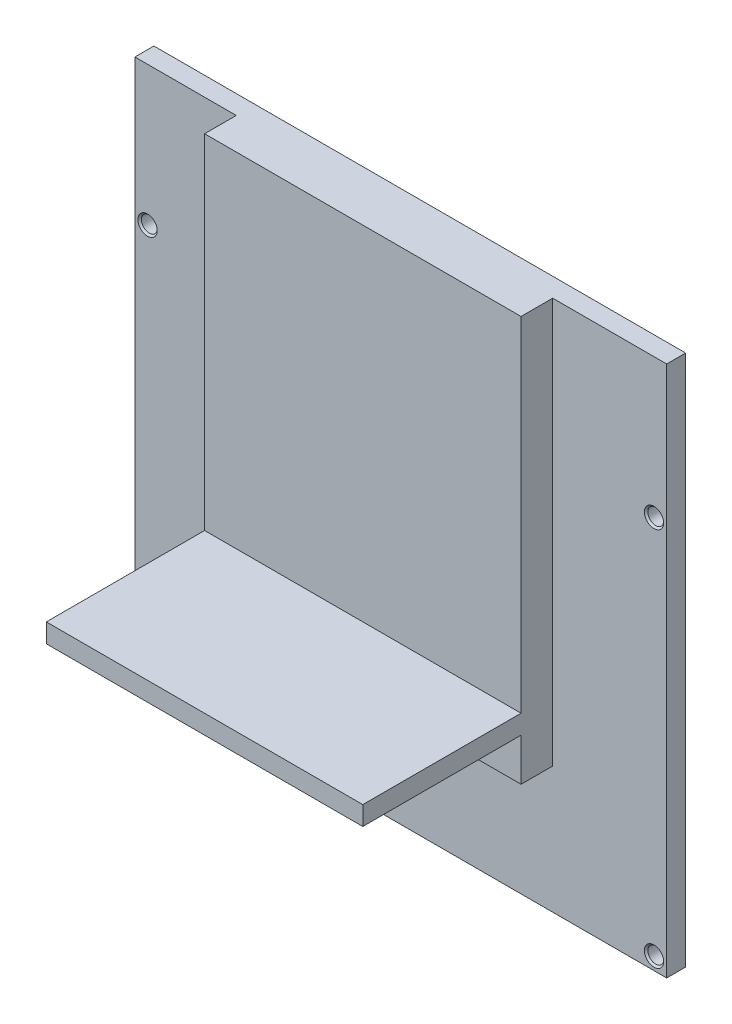
from build123d import *

# Parameters (mm, degrees)
SKETCH_2_W                   = 62
SKETCH_2_H                   = 45
EXTRUDE_3_DEPTH              = 8
SKETCH_3_W                   = 3.004963504
SKETCH_3_H                   = 5
CUT_EXTRUDE_1_DEPTH          = 58.648048048
EXTRUDE_4_DEPTH              = 3
SKETCH_6_W                   = 3
SKETCH_6_H                   = 5
EXTRUDE_5_DEPTH              = 2
SKETCH_7_W                   = 3
SKETCH_7_H                   = 5
EXTRUDE_6_DEPTH              = 2
SKETCH_8_W                   = 49.990072992
SKETCH_8_H                   = 5
EXTRUDE_7_DEPTH              = 2
SKETCH_9_W                   = 3
SKETCH_9_H                   = 5
CUT_EXTRUDE_2_DEPTH          = 66.65020057
SKETCH_10_W                  = 3
SKETCH_10_H                  = 5
CUT_EXTRUDE_4_DEPTH          = 66.65020057
SKETCH_11_W                  = 49.990072992
SKETCH_11_H                  = 5
EXTRUDE_8_DEPTH              = 17
SKETCH_12_W                  = 49.990072992
SKETCH_12_H                  = 3
EXTRUDE_9_DEPTH              = 25
EXTRUDE_START                = 3.72
SKETCH_16_W                  = 49.990072992
SKETCH_16_H                  = 25
EXTRUDE_10_DEPTH             = 3
SKETCH_17_W                  = 49.990072992
SKETCH_17_H                  = 25
CUT_EXTRUDE_5_DEPTH          = 81.043408441
SKETCH_18_W                  = 84
SKETCH_18_H                  = 3
EXTRUDE_11_DEPTH             = 20
HOLE_WIZARD_M3_2_D           = 2.5
HOLE_WIZARD_M3_2_CSINK_D     = 3.05
HOLE_WIZARD_M3_2_CSINK_ANGLE = 90


with BuildPart() as part:
    # 草图2 → 凸台-拉伸3 (new body)
    with BuildSketch(Plane.XY):
        with Locations((-4.132569558, -3.93531014)):
            Rectangle(SKETCH_2_W, SKETCH_2_H)
    extrude(amount=EXTRUDE_3_DEPTH)

    # 草图3 → 切除-拉伸1 (cut, through all)
    with BuildSketch(Plane.XZ.offset(26.43531014)):
        with Locations((-30.630087806, 5.5)):
            Rectangle(SKETCH_3_W, SKETCH_3_H)
        with Locations((22.36494869, 5.5)):
            Rectangle(SKETCH_3_W, SKETCH_3_H)
    extrude(amount=-CUT_EXTRUDE_1_DEPTH, mode=Mode.SUBTRACT)

    # 草图5 → 凸台-拉伸4 (add)
    with BuildSketch(Plane(origin=(0, 0, 0), x_dir=(-1, 0, 0), z_dir=(0, 0, -1))):
        Polygon((-38.867430442, -45.43531014), (-38.867430442, 18.56468986), (45.132569558, 18.56468986), (45.132569558, -45.43531014), (3.132569558, -45.43531014), align=None)
    extrude(amount=-EXTRUDE_4_DEPTH)

    # 草图6 → 凸台-拉伸5 (add)
    with BuildSketch(Plane.XZ.offset(26.43531014)):
        with Locations((-33.632569558, 5.5)):
            Rectangle(SKETCH_6_W, SKETCH_6_H)
    extrude(amount=EXTRUDE_5_DEPTH)

    # 草图7 → 凸台-拉伸6 (add)
    with BuildSketch(Plane.XZ.offset(26.43531014)):
        with Locations((25.367430442, 5.5)):
            Rectangle(SKETCH_7_W, SKETCH_7_H)
    extrude(amount=EXTRUDE_6_DEPTH)

    # 草图8 → 凸台-拉伸7 (add)
    with BuildSketch(Plane.XZ.offset(26.43531014)):
        with Locations((-4.132569558, 5.5)):
            Rectangle(SKETCH_8_W, SKETCH_8_H)
    extrude(amount=EXTRUDE_7_DEPTH)

    # 草图9 → 切除-拉伸2 (cut, through all)
    with BuildSketch(Plane.XZ.offset(28.43531014)):
        with Locations((-33.632569558, 5.5)):
            Rectangle(SKETCH_9_W, SKETCH_9_H)
    extrude(amount=-CUT_EXTRUDE_2_DEPTH, mode=Mode.SUBTRACT)

    # 草图10 → 切除-拉伸4 (cut, through all)
    with BuildSketch(Plane.XZ.offset(28.43531014)):
        with Locations((25.367430442, 5.5)):
            Rectangle(SKETCH_10_W, SKETCH_10_H)
    extrude(amount=-CUT_EXTRUDE_4_DEPTH, mode=Mode.SUBTRACT)

    # 草图11 → 凸台-拉伸8 (add)
    with BuildSketch(Plane.XZ.offset(28.43531014)):
        with Locations((-4.132569558, 5.5)):
            Rectangle(SKETCH_11_W, SKETCH_11_H)
    extrude(amount=EXTRUDE_8_DEPTH)

    # 草图12 → 凸台-拉伸9 (add)
    with BuildSketch(Plane.XY.offset(8)):
        with Locations((-4.132569558, -43.93531014)):
            Rectangle(SKETCH_12_W, SKETCH_12_H)
    extrude(amount=EXTRUDE_9_DEPTH)

    # 草图16 → 凸台-拉伸10 (add)
    with BuildSketch(Plane(origin=(0, -42.43531014, 0), x_dir=(1, 0, 0), z_dir=(0, 1, 0)).offset(EXTRUDE_START)):
        with Locations((-4.132569558, -20.5)):
            Rectangle(SKETCH_16_W, SKETCH_16_H)
    extrude(amount=EXTRUDE_10_DEPTH)

    # 草图17 → 切除-拉伸5 (cut, through all)
    with BuildSketch(Plane.XZ.offset(38.71531014)):
        with Locations((-4.132569558, 20.5)):
            Rectangle(SKETCH_17_W, SKETCH_17_H)
    extrude(amount=CUT_EXTRUDE_5_DEPTH, mode=Mode.SUBTRACT)

    # 草图18 → 凸台-拉伸11 (add)
    with BuildSketch(Plane.XZ.offset(45.43531014)):
        with Locations((-3.132569558, 1.5)):
            Rectangle(SKETCH_18_W, SKETCH_18_H)
    extrude(amount=EXTRUDE_11_DEPTH)

    # M3 螺纹孔2 (through all)
    with Locations(Plane.XY.offset(3)):
        with Locations((-43.132569558, -3.43531014), (36.867430442, -3.43531014), (36.867430442, -63.43531014), (-43.132569558, -63.43531014)):
            CounterSinkHole(HOLE_WIZARD_M3_2_D / 2, HOLE_WIZARD_M3_2_CSINK_D / 2, counter_sink_angle=HOLE_WIZARD_M3_2_CSINK_ANGLE)


solid = part.part
